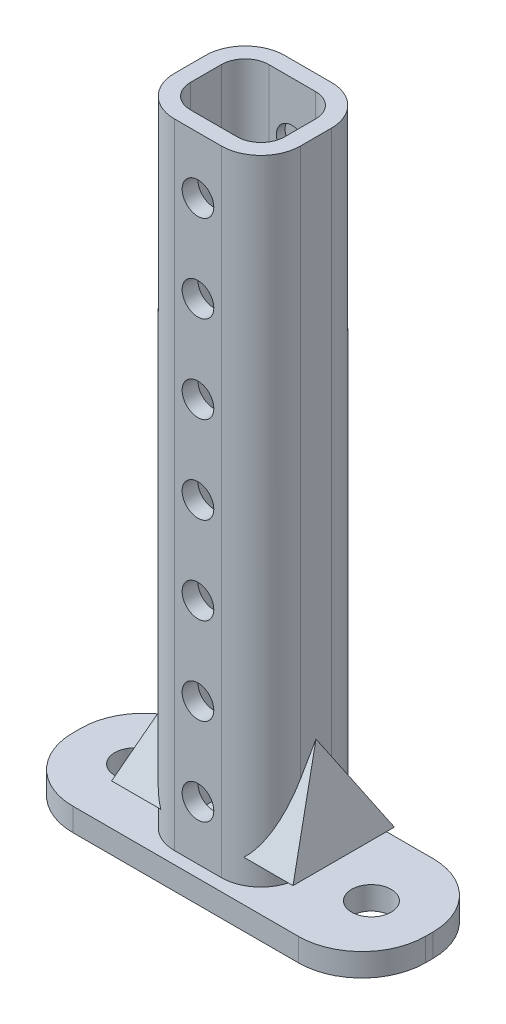
from build123d import *

# Parameters (mm, degrees)
EXTRUDE_1_DEPTH     = 2.9
EXTRUDE_2_DEPTH     = 80
CUT_EXTRUDE_1_DEPTH = 80
SKETCH_5_R          = 2.5
CUT_EXTRUDE_2_DEPTH = 80
EXTRUDE_START       = 1.5
EXTRUDE_3_DEPTH     = 1.5
SKETCH_8_R          = 2
CUT_EXTRUDE_3_DEPTH = 13
EXTRUDE_4_DEPTH     = 3.5
CUT_EXTRUDE_4_DEPTH = 50
CUT_EXTRUDE_5_DEPTH = 80


with BuildPart() as part:
    # 草图1 → 凸台-拉伸1 (new body)
    with BuildSketch(Plane(origin=(0, 0, 0), x_dir=(1, 0, 0), z_dir=(0, 1, 0))):
        with BuildLine():
            Line((-14.25, 8.5), (14.25, 8.5))
            ThreePointArc((14.25, 8.5), (19.906854249, 6.156854249), (22.25, 0.5))
            Line((22.25, 0.5), (22.25, -0.5))
            ThreePointArc((22.25, -0.5), (19.906854249, -6.156854249), (14.25, -8.5))
            Line((14.25, -8.5), (-14.25, -8.5))
            ThreePointArc((-14.25, -8.5), (-19.906854249, -6.156854249), (-22.25, -0.5))
            Line((-22.25, -0.5), (-22.25, 0.5))
            ThreePointArc((-22.25, 0.5), (-19.906854249, 6.156854249), (-14.25, 8.5))
        make_face()
    extrude(amount=EXTRUDE_1_DEPTH)

    # 草图3 → 凸台-拉伸2 (add)
    with BuildSketch(Plane(origin=(0, 2.9, 0), x_dir=(1, 0, 0), z_dir=(0, 1, 0))):
        with BuildLine():
            Line((-2.95, 6.95), (2.95, 6.95))
            ThreePointArc((2.95, 6.95), (6.485533906, 5.485533906), (7.95, 1.95))
            Line((7.95, 1.95), (7.95, -1.95))
            ThreePointArc((7.95, -1.95), (6.485533906, -5.485533906), (2.95, -6.95))
            Line((2.95, -6.95), (-2.95, -6.95))
            ThreePointArc((-2.95, -6.95), (-6.485533906, -5.485533906), (-7.95, -1.95))
            Line((-7.95, -1.95), (-7.95, 1.95))
            ThreePointArc((-7.95, 1.95), (-6.485533906, 5.485533906), (-2.95, 6.95))
        make_face()
    extrude(amount=EXTRUDE_2_DEPTH)

    # 草图4 → 切除-拉伸1 (cut)
    with BuildSketch(Plane(origin=(0, 82.9, 0), x_dir=(1, 0, 0), z_dir=(0, 1, 0))):
        with BuildLine():
            Line((5.95, -1.95), (5.95, 1.95))
            ThreePointArc((5.95, 1.95), (5.071320344, 4.071320344), (2.95, 4.95))
            Line((2.95, 4.95), (-2.95, 4.95))
            ThreePointArc((-2.95, 4.95), (-5.071320344, 4.071320344), (-5.95, 1.95))
            Line((-5.95, 1.95), (-5.95, -1.95))
            ThreePointArc((-5.95, -1.95), (-5.071320344, -4.071320344), (-2.95, -4.95))
            Line((-2.95, -4.95), (2.95, -4.95))
            ThreePointArc((2.95, -4.95), (5.071320344, -4.071320344), (5.95, -1.95))
        make_face()
    extrude(amount=-CUT_EXTRUDE_1_DEPTH, mode=Mode.SUBTRACT)

    # 草图5 → 切除-拉伸2 (cut)
    with BuildSketch(Plane(origin=(0, 2.9, 0), x_dir=(1, 0, 0), z_dir=(0, 1, 0))):
        with Locations(Location((-14.95, 0, 0), (0, 0, 270))):
            Circle(SKETCH_5_R)
        with Locations(Location((14.95, 0, 0), (0, 0, 270))):
            Circle(SKETCH_5_R)
    extrude(amount=-CUT_EXTRUDE_2_DEPTH, mode=Mode.SUBTRACT)

    # 草图7 → 凸台-拉伸3 (add)
    with BuildSketch(Plane(origin=(0, 0, 0), x_dir=(-1, 0, 0), z_dir=(0, -1, 0)).offset(EXTRUDE_START)):
        with BuildLine():
            Line((2.95, -6.95), (-2.95, -6.95))
            ThreePointArc((-2.95, -6.95), (-6.485533906, -5.485533906), (-7.95, -1.95))
            Line((-7.95, -1.95), (-7.95, 1.95))
            ThreePointArc((-7.95, 1.95), (-6.485533906, 5.485533906), (-2.95, 6.95))
            Line((-2.95, 6.95), (2.95, 6.95))
            ThreePointArc((2.95, 6.95), (6.485533906, 5.485533906), (7.95, 1.95))
            Line((7.95, 1.95), (7.95, -1.95))
            ThreePointArc((7.95, -1.95), (6.485533906, -5.485533906), (2.95, -6.95))
        make_face()
    extrude(amount=-EXTRUDE_3_DEPTH)

    # 草图8 → 切除-拉伸3 (cut)
    with BuildSketch(Plane.XY.offset(6.95)):
        with Locations((0, 75.720823604)):
            Circle(SKETCH_8_R)
        with Locations((0, 64.720823604)):
            Circle(SKETCH_8_R)
        with Locations((0, 53.720823604)):
            Circle(SKETCH_8_R)
        with Locations((0, 42.720823604)):
            Circle(SKETCH_8_R)
        with Locations((0, 31.720823604)):
            Circle(SKETCH_8_R)
        with Locations((0, 20.720823604)):
            Circle(SKETCH_8_R)
        with Locations((0, 9.720823604)):
            Circle(SKETCH_8_R)
    extrude(amount=-CUT_EXTRUDE_3_DEPTH, mode=Mode.SUBTRACT)

    # 草图9 → 凸台-拉伸4 (add, symmetric)
    with BuildSketch(Plane.ZY.offset(7.95)):
        Polygon((0, 17.081538124), (-6.397929019, 6), (6.397929019, 6), align=None)
    extrude_4 = extrude(amount=EXTRUDE_4_DEPTH, both=True)

    # 草图10 → 切除-拉伸4 (cut)
    with BuildSketch(Plane.XY.offset(6.95)):
        Polygon((-11.45, 6), (-7.95, 17.081538124), (-15.556844876, 23.601808742), align=None)
    cut_extrude_4 = extrude(amount=-CUT_EXTRUDE_4_DEPTH, mode=Mode.SUBTRACT)

    # 草图12 → 切除-拉伸5 (cut)
    with BuildSketch(Plane(origin=(0, 82.9, 0), x_dir=(1, 0, 0), z_dir=(0, 1, 0))):
        with BuildLine():
            Line((-2.95, -4.95), (2.95, -4.95))
            ThreePointArc((2.95, -4.95), (5.071320344, -4.071320344), (5.95, -1.95))
            Line((5.95, -1.95), (5.95, 1.95))
            ThreePointArc((5.95, 1.95), (5.071320344, 4.071320344), (2.95, 4.95))
            Line((2.95, 4.95), (-2.95, 4.95))
            ThreePointArc((-2.95, 4.95), (-5.071320344, 4.071320344), (-5.95, 1.95))
            Line((-5.95, 1.95), (-5.95, -1.95))
            ThreePointArc((-5.95, -1.95), (-5.071320344, -4.071320344), (-2.95, -4.95))
        make_face()
    cut_extrude_5 = extrude(amount=-CUT_EXTRUDE_5_DEPTH, mode=Mode.SUBTRACT)

    # 镜向2: 凸台-拉伸4 across plane
    add(extrude_4.mirror(Plane(origin=(0, 0, 0), x_dir=(0, 0, 1), z_dir=(1, 0, 0))))

    # 镜向3: 切除-拉伸4, 切除-拉伸5 across plane
    add(cut_extrude_4.mirror(Plane(origin=(0, 0, 0), x_dir=(0, 0, 1), z_dir=(1, 0, 0))), mode=Mode.SUBTRACT)
    add(cut_extrude_5.mirror(Plane(origin=(0, 0, 0), x_dir=(0, 0, 1), z_dir=(1, 0, 0))), mode=Mode.SUBTRACT)


solid = part.part
